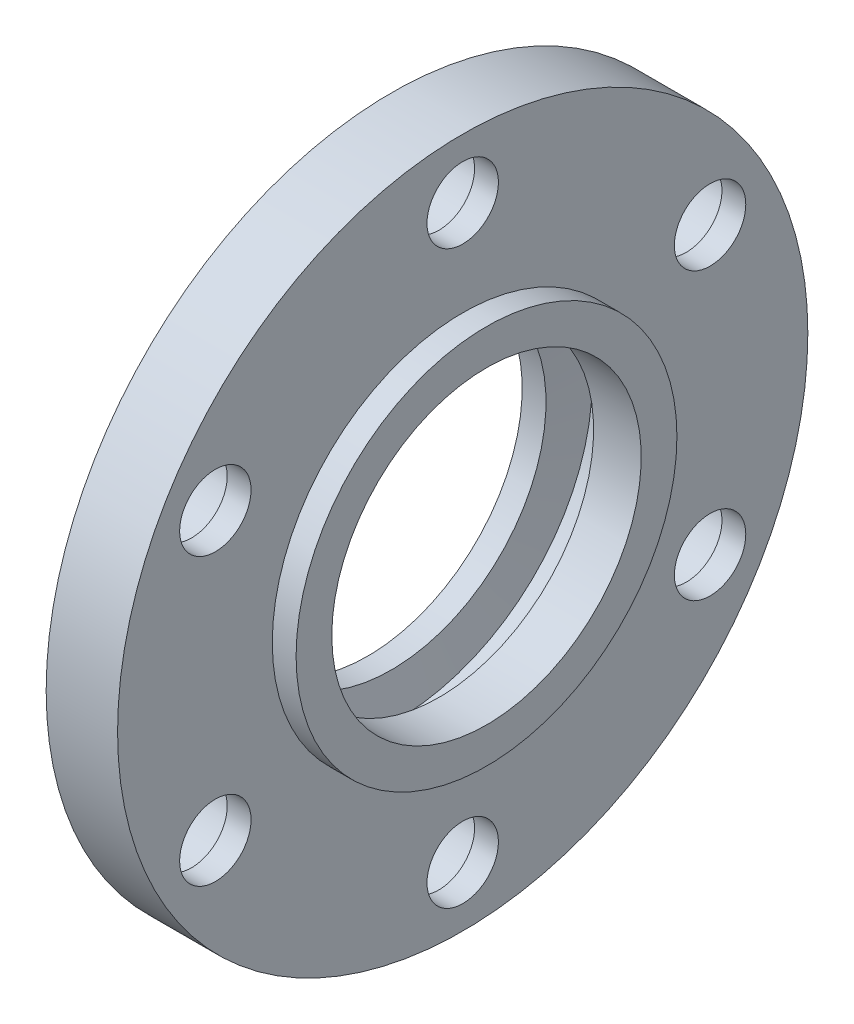
from build123d import *

# Parameters (mm, degrees)
SKETCH_1_W                = 6
SKETCH_1_H                = 29
SKETCH_2_R                = 19.5
EXTRUDE_1_DEPTH           = 2
EXTRUDE_1_TAPER           = 45
SKETCH_3_R                = 16
EXTRUDE_2_DEPTH           = 2
HOLE_WIZARD_1_D           = 6
HOLE_WIZARD_1_DEPTH       = 8
HOLE_WIZARD_1_CBORE_D     = 8.5
HOLE_WIZARD_1_CBORE_DEPTH = 4


with BuildPart() as part:
    # Эскиз1 → Повернуть1 (revolve)
    with BuildSketch(Plane.XY, mode=Mode.PRIVATE) as revolve_1_sk:
        with Locations((5, 14.5)):
            Rectangle(SKETCH_1_W, SKETCH_1_H)
    revolve(revolve_1_sk.sketch.rotate(Axis((2, 0, 0), (1, 0, 0)), 270), axis=Axis((2, 0, 0), (1, 0, 0)))

    # Эскиз2 → Бобышка-Вытянуть1 (add)
    with BuildSketch(Plane.ZY.offset(-2)):
        Circle(SKETCH_2_R)
    extrude(amount=EXTRUDE_1_DEPTH, taper=EXTRUDE_1_TAPER)

    # Эскиз3 → Бобышка-Вытянуть2 (add)
    with BuildSketch(Plane(origin=(8, 0, 0), x_dir=(0, 0, -1), z_dir=(1, 0, 0))):
        Circle(SKETCH_3_R)
    extrude(amount=EXTRUDE_2_DEPTH)

    # Эскиз4 → Вырез-Повернуть1 (revolve, cut)
    with BuildSketch(Plane(origin=(0, 0, 0), x_dir=(-1, 0, 0), z_dir=(0, 0, -1)), mode=Mode.PRIVATE) as cut_revolve_1_sk:
        Polygon((-10, 13), (-10, 0), (0, 0), (0, 13), (-2, 13), (-2.5, 16.373590872), (-5.5, 16.373590872), (-6, 13), align=None)
    revolve(cut_revolve_1_sk.sketch.rotate(Axis((10, 0, 0), (-1, 0, 0)), 270), axis=Axis((10, 0, 0), (-1, 0, 0)), mode=Mode.SUBTRACT)

    # Отверстие1
    with Locations(Plane.ZY.offset(-2)):
        with Locations((20.784609691, -12), (0, -24), (-20.784609691, -12), (-20.784609691, 12), (0, 24), (20.784609691, 12)):
            CounterBoreHole(HOLE_WIZARD_1_D / 2, HOLE_WIZARD_1_CBORE_D / 2, HOLE_WIZARD_1_CBORE_DEPTH, depth=HOLE_WIZARD_1_DEPTH)


solid = part.part
